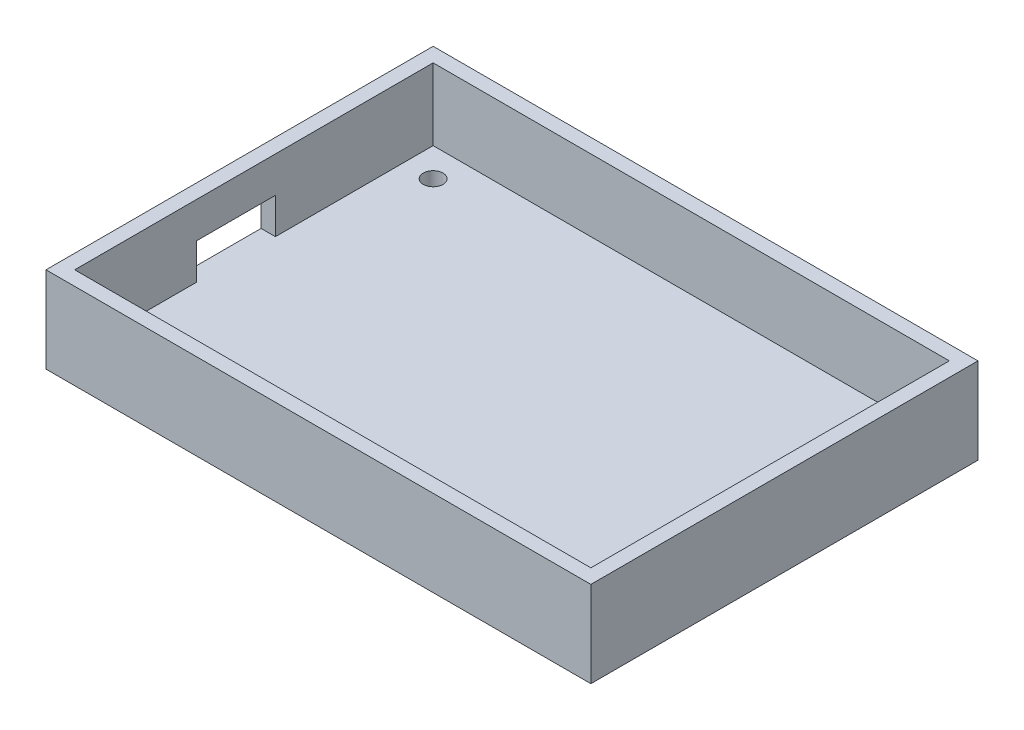
from build123d import *

# Parameters (mm, degrees)
SKETCH1_W           = 96.52
SKETCH1_H           = 68.58
BOSS_EXTRUDE2_DEPTH = 2.54
SKETCH4_W           = 96.52
SKETCH4_H           = 68.58
SKETCH4_W_2         = 91.44
SKETCH4_H_2         = 63.5
BOSS_EXTRUDE3_DEPTH = 12.7
SKETCH5_W           = 13.97
SKETCH5_H           = 6.35
CUT_EXTRUDE2_DEPTH  = 12.7
SKETCH6_R           = 1.75
CUT_EXTRUDE4_DEPTH  = 2.54


with BuildPart() as part:
    # Sketch1 → Boss-Extrude2 (new body)
    with BuildSketch(Plane(origin=(0, 0, 0), x_dir=(1, 0, 0), z_dir=(0, 1, 0))):
        Rectangle(SKETCH1_W, SKETCH1_H)
    extrude(amount=BOSS_EXTRUDE2_DEPTH)

    # Sketch4 → Boss-Extrude3 (add)
    with BuildSketch(Plane(origin=(0, 2.54, 0), x_dir=(1, 0, 0), z_dir=(0, 1, 0))):
        Rectangle(SKETCH4_W, SKETCH4_H)
        Rectangle(SKETCH4_W_2, SKETCH4_H_2, mode=Mode.SUBTRACT)
    extrude(amount=BOSS_EXTRUDE3_DEPTH)

    # Sketch5 → Cut-Extrude2 (cut)
    with BuildSketch(Plane.ZY.offset(48.26)):
        with Locations((3.175, 5.715)):
            Rectangle(SKETCH5_W, SKETCH5_H)
    extrude(amount=-CUT_EXTRUDE2_DEPTH, mode=Mode.SUBTRACT)

    # Sketch6 → Cut-Extrude4 (cut)
    with BuildSketch(Plane(origin=(0, 2.54, 0), x_dir=(1, 0, 0), z_dir=(0, 1, 0))):
        with Locations(Location((-40.64, 26.67, 0), (0, 0, 270))):
            Circle(SKETCH6_R)
        with Locations(Location((39.37, 26.416, 0), (0, 0, 270))):
            Circle(SKETCH6_R)
        with Locations(Location((39.37, -25.654, 0), (0, 0, 270))):
            Circle(SKETCH6_R)
    extrude(amount=-CUT_EXTRUDE4_DEPTH, mode=Mode.SUBTRACT)


solid = part.part
